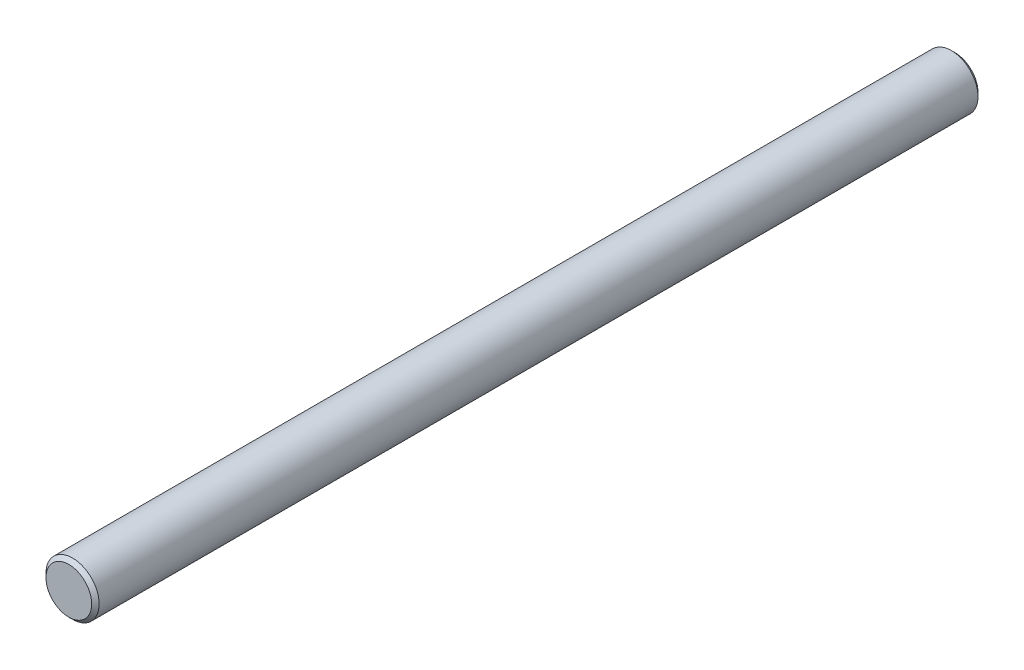
from build123d import *

# Parameters (mm, degrees)
BOSS_EXTRUDE1_DEPTH      = 50
BOSS_EXTRUDE1_DEPTH_BACK = 50
SKETCH3_R                = 3
CHAMFER1_SIZE            = 0.42


with BuildPart() as part:
    # Sketch3 → Boss-Extrude1 (new, two sides: drawn at the far end of the back side and taken through both)
    with BuildSketch(Plane.XY.offset(-BOSS_EXTRUDE1_DEPTH_BACK)):
        Circle(SKETCH3_R)
    extrude(amount=BOSS_EXTRUDE1_DEPTH + BOSS_EXTRUDE1_DEPTH_BACK)

    # Chamfer1
    chamfer1_edges = [part.edges().sort_by_distance(p)[0] for p in [
        (-3, 0, -50),
        (-3, 0, 50),
    ]]
    chamfer(chamfer1_edges, length=CHAMFER1_SIZE)


solid = part.part
